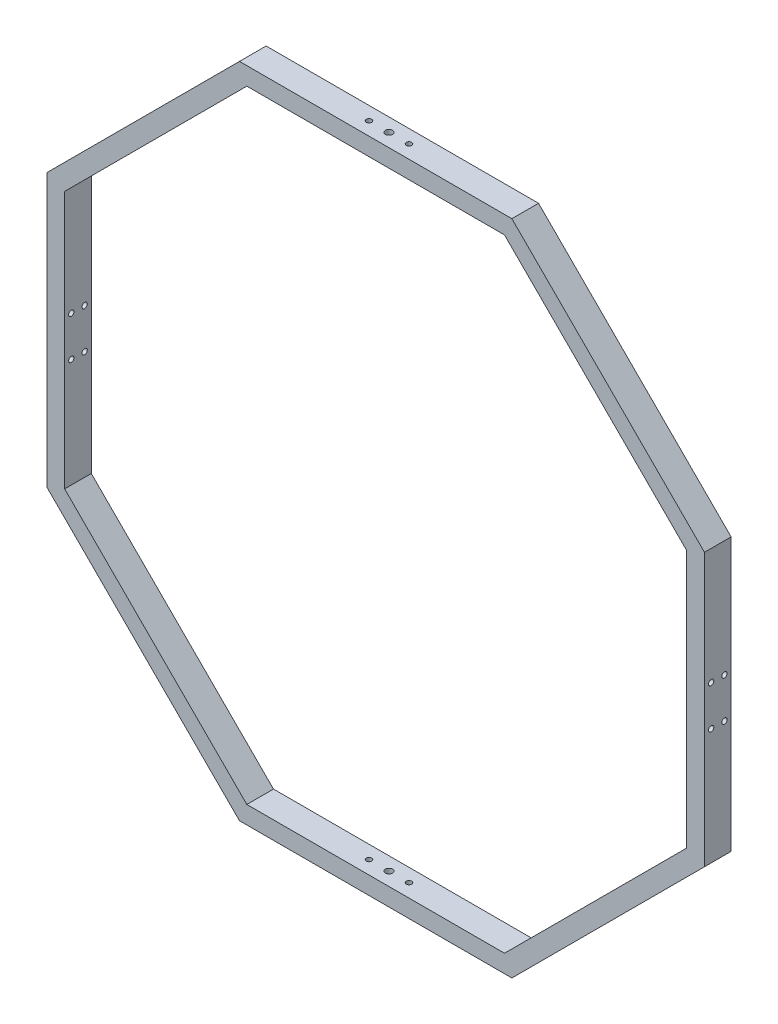
from build123d import *

# Parameters (mm, degrees)
BOSS_EXTRUDE1_DEPTH = 60
SKETCH4_R           = 8
SKETCH4_R_2         = 6
CUT_EXTRUDE1_DEPTH  = 1968
SKETCH6_R           = 6
CUT_EXTRUDE2_DEPTH  = 1968


with BuildPart() as part:
    # Sketch2 → Boss-Extrude1 (new body)
    with BuildSketch(Plane.XY):
        Polygon((740, 306.518036156), (306.518036156, 740), (-306.518036156, 740), (-740, 306.518036156), (-740, -306.518036156), (-306.518036156, -740), (306.518036156, -740), (740, -306.518036156), align=None)
        Polygon((700, -289.949493661), (700, 289.949493661), (289.949493661, 700), (-289.949493661, 700), (-700, 289.949493661), (-700, -289.949493661), (-289.949493661, -700), (289.949493661, -700), align=None, mode=Mode.SUBTRACT)
    extrude(amount=BOSS_EXTRUDE1_DEPTH)

    # Sketch4 → Cut-Extrude1 (cut)
    with BuildSketch(Plane.XZ.offset(740)):
        with Locations(Location((0, 30, 0), (0, 0, 270))):
            Circle(SKETCH4_R)
        with Locations(Location((-45, 30, 0), (0, 0, 270))):
            Circle(SKETCH4_R_2)
        with Locations(Location((45, 30, 0), (0, 0, 270))):
            Circle(SKETCH4_R_2)
    extrude(amount=-CUT_EXTRUDE1_DEPTH, mode=Mode.SUBTRACT)

    # Sketch6 → Cut-Extrude2 (cut)
    with BuildSketch(Plane(origin=(740, 0, 0), x_dir=(0, 0, -1), z_dir=(1, 0, 0))):
        with Locations((-15, 45)):
            Circle(SKETCH6_R)
        with Locations((-15, -45)):
            Circle(SKETCH6_R)
        with Locations((-45, 45)):
            Circle(SKETCH6_R)
        with Locations((-45, -45)):
            Circle(SKETCH6_R)
    extrude(amount=-CUT_EXTRUDE2_DEPTH, mode=Mode.SUBTRACT)


solid = part.part
